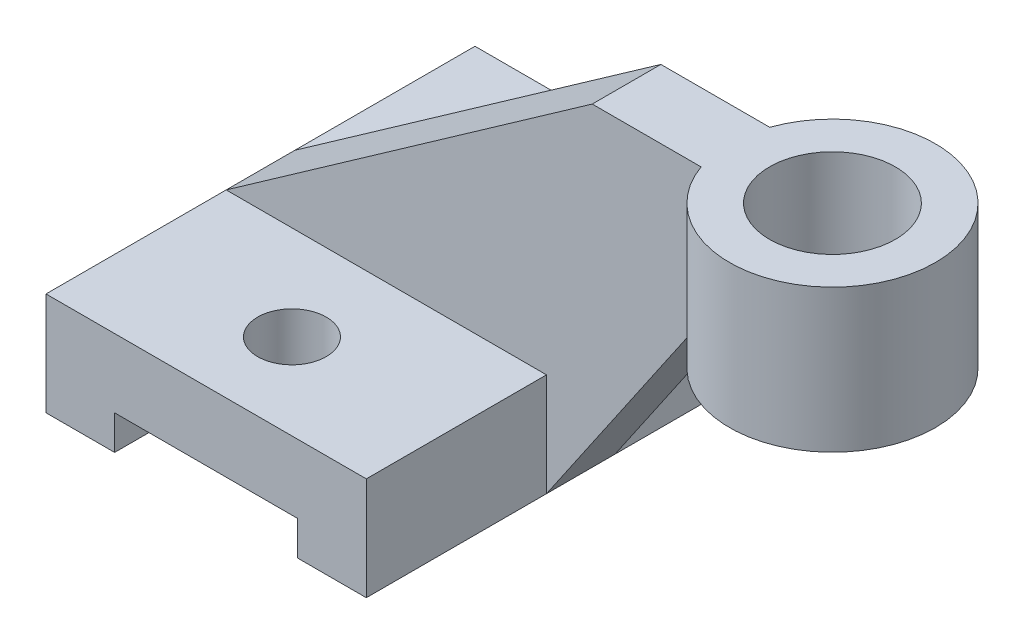
from build123d import *

# Parameters (mm, degrees)
BOSS_EXTRUDE1_DEPTH = 75
SKETCH2_R           = 6
CUT_EXTRUDE1_DEPTH  = 96.315266353
BOSS_EXTRUDE2_DEPTH = 6
SKETCH4_R           = 18
BOSS_EXTRUDE3_DEPTH = 25
SKETCH5_R           = 11
CUT_EXTRUDE2_DEPTH  = 154.355795456


with BuildPart() as part:
    # Sketch1 → Boss-Extrude1 (new body)
    with BuildSketch(Plane.XY):
        Polygon((0, 0), (12, 0), (12, 6), (44, 6), (44, 0), (56, 0), (56, 18), (0, 18), align=None)
    extrude(amount=-BOSS_EXTRUDE1_DEPTH)

    # Sketch2 → Cut-Extrude1 (cut, through all)
    with BuildSketch(Plane(origin=(0, 18, 0), x_dir=(1, 0, 0), z_dir=(0, 1, 0))):
        with Locations(Location((28, 15, 0), (0, 0, 180))):
            Circle(SKETCH2_R)
        with Locations(Location((28, 60, 0), (0, 0, 180))):
            Circle(SKETCH2_R)
    extrude(amount=-CUT_EXTRUDE1_DEPTH, mode=Mode.SUBTRACT)

    # Sketch3 → Boss-Extrude2 (add, symmetric)
    with BuildSketch(Plane.XY.offset(-37.5)):
        Polygon((0, 18), (64, 63), (100, 63), (100, 38), (82, 38), (56, 0), (56, 18), align=None)
    extrude(amount=BOSS_EXTRUDE2_DEPTH, both=True)

    # Sketch4 → Boss-Extrude3 (add)
    with BuildSketch(Plane(origin=(0, 63, 0), x_dir=(1, 0, 0), z_dir=(0, 1, 0))):
        with Locations((100, 37.5)):
            Circle(SKETCH4_R)
    extrude(amount=-BOSS_EXTRUDE3_DEPTH)

    # Sketch5 → Cut-Extrude2 (cut, through all)
    with BuildSketch(Plane(origin=(0, 63, 0), x_dir=(1, 0, 0), z_dir=(0, 1, 0))):
        with Locations(Location((100, 37.5, 0), (0, 0, 270))):
            Circle(SKETCH5_R)
    extrude(amount=-CUT_EXTRUDE2_DEPTH, mode=Mode.SUBTRACT)


solid = part.part
